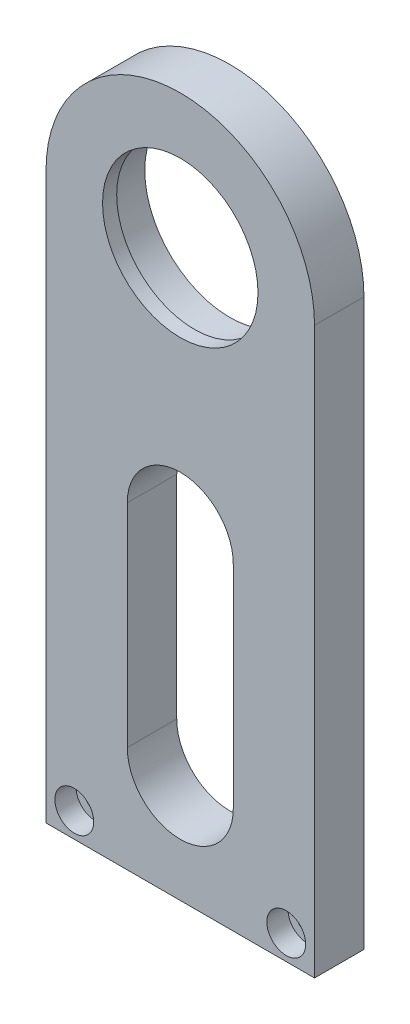
from build123d import *

# Parameters (mm, degrees)
SKETCH_1_R         = 11
SKETCH_1_R_2       = 1.55
SKETCH_1_R_3       = 19
EXTRUDE_1_DEPTH    = 7
SKETCH1_R          = 2.75
CUT_EXTRUDE1_DEPTH = 3
SKETCH2_R          = 12.025
CUT_EXTRUDE2_DEPTH = 5


with BuildPart() as part:
    # 草图1 → 凸台-拉伸1 (new body)
    # profile 1 of 3: a face of its own
    with BuildSketch(Plane.XY):
        with BuildLine():
            ThreePointArc((19, 80), (0, 99), (-19, 80))
            ThreePointArc((-19, 80), (0, 61), (19, 80))
        make_face()
        with Locations((0, 80)):
            Circle(SKETCH_1_R, mode=Mode.SUBTRACT)
    # profile 2 of 3: a face of its own
    with BuildSketch(Plane.XY):
        with BuildLine():
            Line((-19, 7), (-19, 0))
            Line((-19, 0), (19, 0))
            Line((19, 0), (19, 7))
            Line((19, 7), (19, 80))
            ThreePointArc((19, 80), (0, 61), (-19, 80))
            Line((-19, 80), (-19, 7))
        make_face()
        with Locations((-15, 3.5)):
            Circle(SKETCH_1_R_2, mode=Mode.SUBTRACT)
        with BuildLine():
            ThreePointArc((-7.5, 45), (0, 52.5), (7.5, 45))
            Line((7.5, 45), (7.5, 15))
            ThreePointArc((7.5, 15), (0, 7.5), (-7.5, 15))
            Line((-7.5, 15), (-7.5, 45))
        make_face(mode=Mode.SUBTRACT)
        with Locations((15, 3.5)):
            Circle(SKETCH_1_R_2, mode=Mode.SUBTRACT)
    # profile 3 of 3: a face of its own
    with BuildSketch(Plane.XY):
        with Locations((0, 80)):
            Circle(SKETCH_1_R_3)
        with Locations((0, 80)):
            Circle(SKETCH_1_R, mode=Mode.SUBTRACT)
    extrude(amount=EXTRUDE_1_DEPTH)

    # Sketch1 → Cut-Extrude1 (cut)
    with BuildSketch(Plane.XY.offset(7)):
        with Locations((15, 3.5)):
            Circle(SKETCH1_R)
        with Locations(Location((-15, 3.5, 0), (0, 0, 180))):
            Circle(SKETCH1_R)
    extrude(amount=-CUT_EXTRUDE1_DEPTH, mode=Mode.SUBTRACT)

    # Sketch2 → Cut-Extrude2 (cut)
    with BuildSketch(Plane(origin=(0, 0, 0), x_dir=(-1, 0, 0), z_dir=(0, 0, -1))):
        with Locations((0, 80)):
            Circle(SKETCH2_R)
    extrude(amount=-CUT_EXTRUDE2_DEPTH, mode=Mode.SUBTRACT)


solid = part.part
